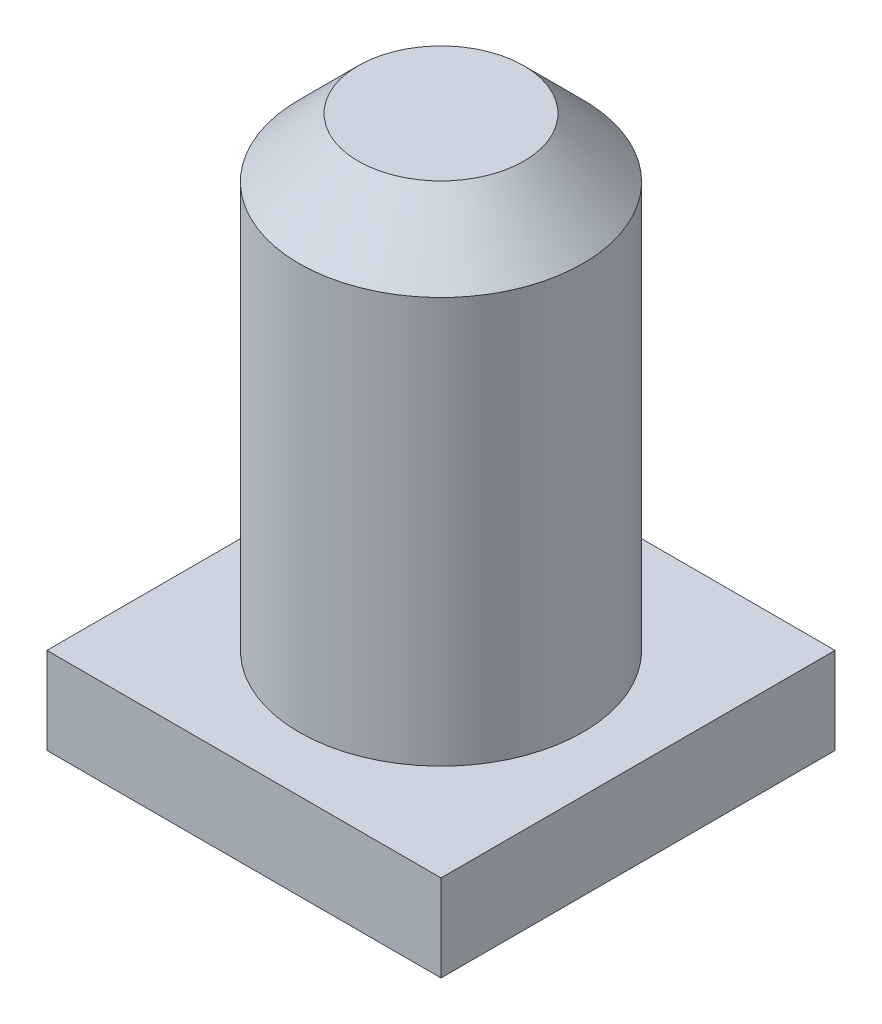
from build123d import *

# Parameters (mm, degrees)
SKETCH1_R           = 1.8
BOSS_EXTRUDE1_DEPTH = 7
SKETCH3_W           = 5
SKETCH3_H           = 5
BOSS_EXTRUDE2_DEPTH = 1.1
CHAMFER1_SIZE       = 0.75


with BuildPart() as part:
    # Sketch1 → Boss-Extrude1 (new body)
    with BuildSketch(Plane(origin=(0, 0, 0), x_dir=(1, 0, 0), z_dir=(0, 1, 0))):
        with Locations(Location((0, 0, 0), (0, 0, 270))):
            Circle(SKETCH1_R)
    extrude(amount=BOSS_EXTRUDE1_DEPTH)

    # Sketch3 → Boss-Extrude2 (add)
    with BuildSketch(Plane.XZ):
        Rectangle(SKETCH3_W, SKETCH3_H)
    extrude(amount=-BOSS_EXTRUDE2_DEPTH)

    # Chamfer1
    chamfer1_edges = [part.edges().sort_by_distance(p)[0] for p in [
        (0, 7, -1.8),
    ]]
    chamfer(chamfer1_edges, length=CHAMFER1_SIZE)


solid = part.part
